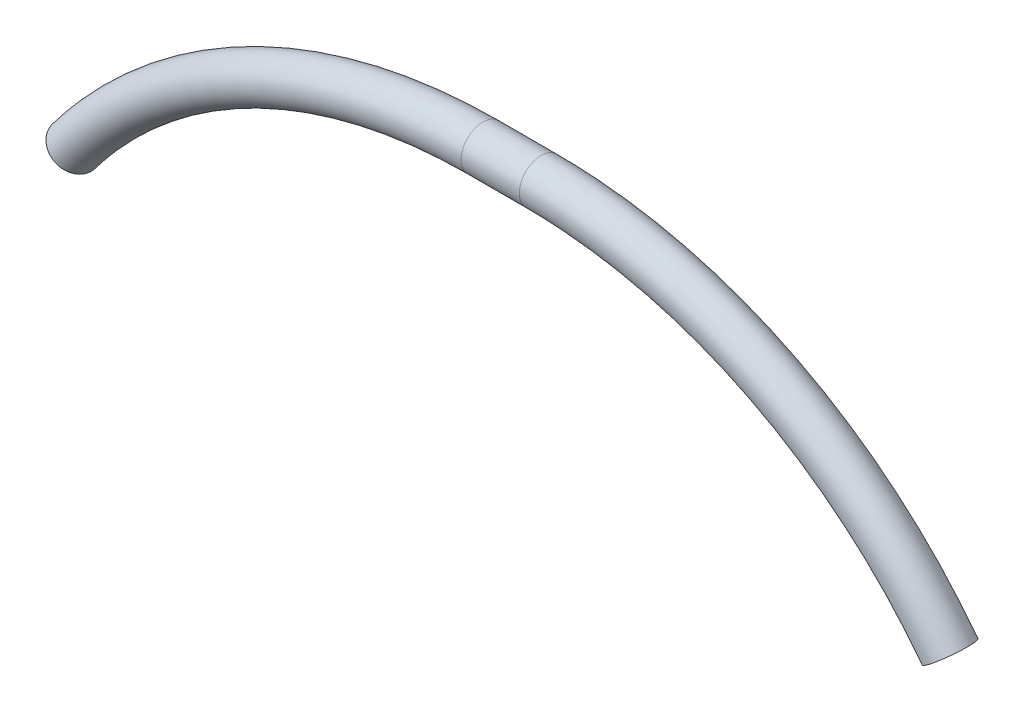
from build123d import *

# Parameters (mm, degrees)
SKETCH1_R      = 4.7625
SKETCH1_R_2    = 3.175
EXTRUDE1_DEPTH = 6.35
SKETCH3_R      = 4.7625
SKETCH3_R_2    = 3.175
SKETCH5_R      = 4.7625
SKETCH5_R_2    = 3.175


with BuildPart() as part:
    # Sketch1 → Extrude1 (new, symmetric)
    with BuildSketch(Plane(origin=(0, 0, 0), x_dir=(0, 0, -1), z_dir=(1, 0, 0))):
        Circle(SKETCH1_R)
        Circle(SKETCH1_R_2, mode=Mode.SUBTRACT)
    extrude(amount=EXTRUDE1_DEPTH, both=True)

    # Sweep1: sweep along a path in Sketch6
    with BuildLine(Plane.XY) as sweep1_path:
        ThreePointArc((-6.35, 0), (-56.222049707, -11.726919872), (-95.642120974, -44.45))
    # Sketch3 → Sweep1 (sweep)
    with BuildSketch(Plane.ZY.offset(6.35)):
        Circle(SKETCH3_R)
        Circle(SKETCH3_R_2, mode=Mode.SUBTRACT)
    sweep(path=sweep1_path.line)

    # Sweep2: sweep along a path in Sketch4
    with BuildLine(Plane.XY) as sweep2_path:
        ThreePointArc((95.642120974, -44.45), (56.222049707, -11.726919872), (6.35, 0))
    # Sketch5 → Sweep2 (sweep)
    with BuildSketch(Plane(origin=(6.35, 0, 0), x_dir=(0, 0, -1), z_dir=(1, 0, 0))):
        Circle(SKETCH5_R)
        Circle(SKETCH5_R_2, mode=Mode.SUBTRACT)
    sweep(path=sweep2_path.line)


solid = part.part
